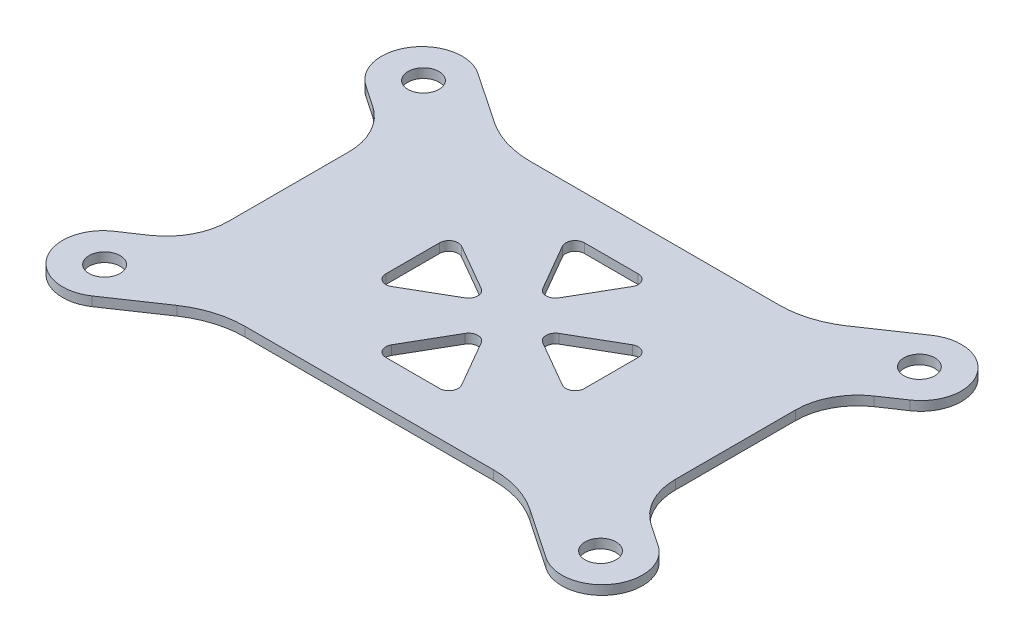
from build123d import *

# Parameters (mm, degrees)
SKETCH1_W           = 72
SKETCH1_H           = 46
BOSS_EXTRUDE1_DEPTH = 1.5
BOSS_EXTRUDE2_DEPTH = 1.5
FILLET1_R           = 10
FILLET2_R           = 15
SKETCH4_R           = 2.5
CUT_EXTRUDE1_DEPTH  = 57.751394231
CUT_EXTRUDE2_DEPTH  = 57.751394231


with BuildPart() as part:
    # Sketch1 → Boss-Extrude1 (new body)
    with BuildSketch(Plane(origin=(0, 0, 0), x_dir=(1, 0, 0), z_dir=(0, 1, 0))):
        Rectangle(SKETCH1_W, SKETCH1_H)
    extrude(amount=BOSS_EXTRUDE1_DEPTH)

    # Sketch2 → Boss-Extrude2 (add)
    with BuildSketch(Plane(origin=(0, 0, 0), x_dir=(-1, 0, 0), z_dir=(0, -1, 0))):
        with BuildLine():
            Line((43.855417409, -20.308053614), (27.33033513, -9.129656043))
            Line((27.33033513, -9.129656043), (20.046462909, -19.897441585))
            Line((20.046462909, -19.897441585), (36.571545189, -31.075839157))
            ThreePointArc((36.571545189, -31.075839157), (45.59737407, -29.333882496), (43.855417409, -20.308053614))
        make_face()
        with BuildLine():
            Line((43.855417409, 20.308053614), (27.867856538, 9.493262584))
            Line((27.867856538, 9.493262584), (20.583984318, 20.261048126))
            Line((20.583984318, 20.261048126), (36.571545189, 31.075839157))
            ThreePointArc((36.571545189, 31.075839157), (45.59737407, 29.333882496), (43.855417409, 20.308053614))
        make_face()
        with BuildLine():
            Line((-36.571545189, 31.075839157), (-20.303290898, 20.071172966))
            Line((-20.303290898, 20.071172966), (-27.587163118, 9.303387424))
            Line((-27.587163118, 9.303387424), (-43.855417409, 20.308053614))
            ThreePointArc((-43.855417409, 20.308053614), (-45.59737407, 29.333882496), (-36.571545189, 31.075839157))
        make_face()
        with BuildLine():
            Line((-43.855417409, -20.308053614), (-27.377969487, -9.161878321))
            Line((-27.377969487, -9.161878321), (-20.094097267, -19.929663863))
            Line((-20.094097267, -19.929663863), (-36.571545189, -31.075839157))
            ThreePointArc((-36.571545189, -31.075839157), (-45.59737407, -29.333882496), (-43.855417409, -20.308053614))
        make_face()
    extrude(amount=-BOSS_EXTRUDE2_DEPTH)

    # Fillet1
    fillet1_edges = [part.edges().sort_by_distance(p)[0] for p in [
        (36, 0.75, -14.994253816),
        (36, 0.75, 14.994253816),
        (-36, 0.75, -14.994253816),
        (-36, 0.75, 14.994253816),
    ]]
    fillet(fillet1_edges, radius=FILLET1_R)

    # Fillet2
    fillet2_edges = [part.edges().sort_by_distance(p)[0] for p in [
        (24.632990876, 0.75, -23),
        (24.632990876, 0.75, 23),
        (-24.632990876, 0.75, -23),
        (-24.632990876, 0.75, 23),
    ]]
    fillet(fillet2_edges, radius=FILLET2_R)

    # Sketch4 → Cut-Extrude1 (cut, through all)
    with BuildSketch(Plane(origin=(0, 1.5, 0), x_dir=(1, 0, 0), z_dir=(0, 1, 0))):
        with Locations(Location((-39.954311998, -25.688576308, 0), (0, 0, 270))):
            Circle(SKETCH4_R)
        with Locations(Location((39.954311998, 25.688576308, 0), (0, 0, 270))):
            Circle(SKETCH4_R)
        with Locations(Location((-39.954311998, 25.688576308, 0), (0, 0, 270))):
            Circle(SKETCH4_R)
        with Locations(Location((39.954311998, -25.688576308, 0), (0, 0, 270))):
            Circle(SKETCH4_R)
    extrude(amount=-CUT_EXTRUDE1_DEPTH, mode=Mode.SUBTRACT)

    # Sketch5 → Cut-Extrude2 (cut, through all)
    with BuildSketch(Plane(origin=(0, 1.5, 0), x_dir=(1, 0, 0), z_dir=(0, 1, 0))):
        with BuildLine():
            Line((1.299038106, 6.25), (5.629165125, 13.75))
            ThreePointArc((5.629165125, 13.75), (5.629165125, 15.25), (4.330127019, 16))
            Line((4.330127019, 16), (-4.330127019, 16))
            ThreePointArc((-4.330127019, 16), (-5.629165125, 15.25), (-5.629165125, 13.75))
            Line((-5.629165125, 13.75), (-1.299038106, 6.25))
            ThreePointArc((-1.299038106, 6.25), (0, 5.5), (1.299038106, 6.25))
        make_face()
        with BuildLine():
            Line((-1.299038106, -6.25), (-5.629165125, -13.75))
            ThreePointArc((-5.629165125, -13.75), (-5.629165125, -15.25), (-4.330127019, -16))
            Line((-4.330127019, -16), (4.330127019, -16))
            ThreePointArc((4.330127019, -16), (5.629165125, -15.25), (5.629165125, -13.75))
            Line((5.629165125, -13.75), (1.299038106, -6.25))
            ThreePointArc((1.299038106, -6.25), (0, -5.5), (-1.299038106, -6.25))
        make_face()
        with BuildLine():
            Line((-6.25, 1.299038106), (-13.75, 5.629165125))
            ThreePointArc((-13.75, 5.629165125), (-15.25, 5.629165125), (-16, 4.330127019))
            Line((-16, 4.330127019), (-16, -4.330127019))
            ThreePointArc((-16, -4.330127019), (-15.25, -5.629165125), (-13.75, -5.629165125))
            Line((-13.75, -5.629165125), (-6.25, -1.299038106))
            ThreePointArc((-6.25, -1.299038106), (-5.5, 0), (-6.25, 1.299038106))
        make_face()
        with BuildLine():
            Line((6.25, -1.299038106), (13.75, -5.629165125))
            ThreePointArc((13.75, -5.629165125), (15.25, -5.629165125), (16, -4.330127019))
            Line((16, -4.330127019), (16, 4.330127019))
            ThreePointArc((16, 4.330127019), (15.25, 5.629165125), (13.75, 5.629165125))
            Line((13.75, 5.629165125), (6.25, 1.299038106))
            ThreePointArc((6.25, 1.299038106), (5.5, 0), (6.25, -1.299038106))
        make_face()
    extrude(amount=-CUT_EXTRUDE2_DEPTH, mode=Mode.SUBTRACT)


solid = part.part
